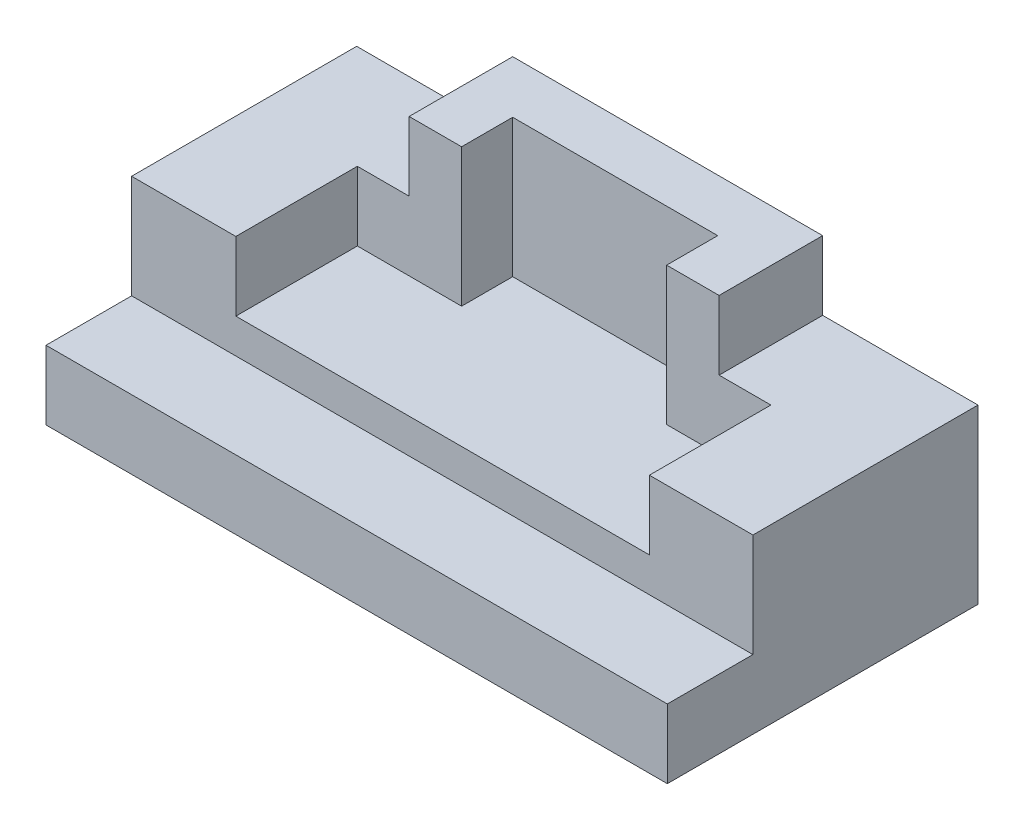
from build123d import *

# Parameters (mm, degrees)
BOSS_EXTRUDE1_DEPTH = 57.15
BOSS_EXTRUDE2_DEPTH = 12.7
CUT_EXTRUDE1_DEPTH  = 25.4


with BuildPart() as part:
    # Sketch1 → Boss-Extrude1 (new, symmetric)
    with BuildSketch(Plane(origin=(0, 0, 0), x_dir=(0, 0, -1), z_dir=(1, 0, 0))):
        Polygon((-28.575, 0), (28.575, 0), (28.575, 31.75), (-12.827, 31.75), (-12.827, 12.7), (-28.575, 12.7), align=None)
    extrude(amount=BOSS_EXTRUDE1_DEPTH, both=True)

    # Sketch2 → Boss-Extrude2 (add)
    with BuildSketch(Plane(origin=(0, 31.75, 0), x_dir=(1, 0, 0), z_dir=(0, 1, 0))):
        Polygon((-28.448, 28.575), (28.575, 28.575), (28.575, 9.525), (18.923, 9.525), (18.923, 18.923), (-18.796, 18.923), (-18.796, 9.525), (-28.448, 9.525), align=None)
    extrude(amount=BOSS_EXTRUDE2_DEPTH)

    # Sketch3 → Cut-Extrude1 (cut)
    with BuildSketch(Plane(origin=(0, 44.45, 0), x_dir=(1, 0, 0), z_dir=(0, 1, 0))):
        Polygon((-18.796, 9.525), (-18.796, 18.923), (18.923, 18.923), (18.923, 9.525), (38.1, 9.525), (38.1, -12.827), (-37.973, -12.827), (-37.973, 9.525), align=None)
    extrude(amount=-CUT_EXTRUDE1_DEPTH, mode=Mode.SUBTRACT)


solid = part.part
